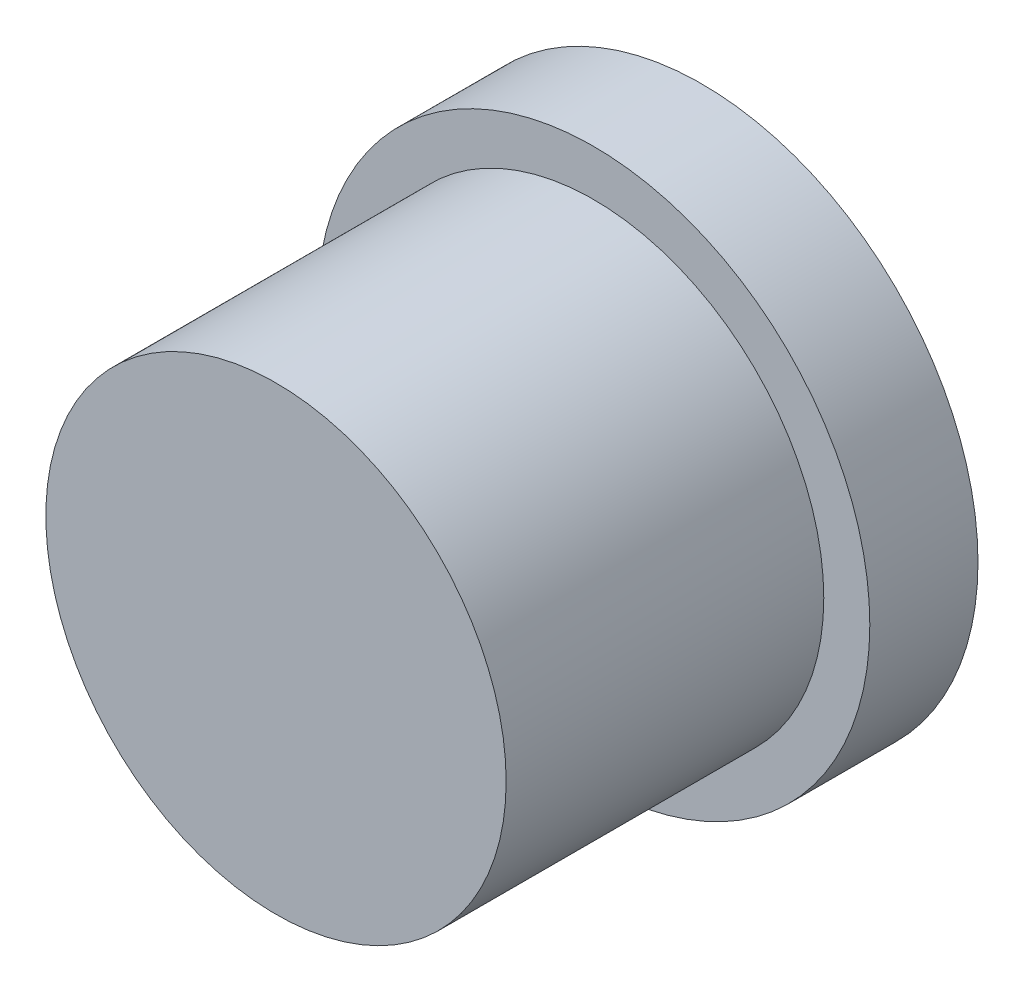
from build123d import *

# Parameters (mm, degrees)
SKETCH1_R           = 24
SKETCH1_R_2         = 1
BOSS_EXTRUDE1_DEPTH = 9.4
SKETCH1_4_R         = 20
BOSS_EXTRUDE2_DEPTH = 37
SKETCH1_5_R         = 17.5
SKETCH1_5_R_2       = 1
BOSS_EXTRUDE3_DEPTH = 4.5


with BuildPart() as part:
    # Sketch1 → Boss-Extrude1 (new body)
    with BuildSketch(Plane.XY):
        Circle(SKETCH1_R)
        with Locations((0, 12.5)):
            Circle(SKETCH1_R_2, mode=Mode.SUBTRACT)
        with Locations((0, -12.5)):
            Circle(SKETCH1_R_2, mode=Mode.SUBTRACT)
        with Locations((12.5, 0)):
            Circle(SKETCH1_R_2, mode=Mode.SUBTRACT)
        with Locations((-12.5, 0)):
            Circle(SKETCH1_R_2, mode=Mode.SUBTRACT)
    extrude(amount=BOSS_EXTRUDE1_DEPTH)

    # Sketch1<4> → Boss-Extrude2 (add)
    with BuildSketch(Plane.XY):
        Circle(SKETCH1_4_R)
    extrude(amount=BOSS_EXTRUDE2_DEPTH)

    # Sketch1<5> → Boss-Extrude3 (add)
    with BuildSketch(Plane.XY):
        Circle(SKETCH1_5_R)
        with Locations((0, -12.5)):
            Circle(SKETCH1_5_R_2, mode=Mode.SUBTRACT)
        with Locations((12.5, 0)):
            Circle(SKETCH1_5_R_2, mode=Mode.SUBTRACT)
        with Locations((-12.5, 0)):
            Circle(SKETCH1_5_R_2, mode=Mode.SUBTRACT)
        with Locations((0, 12.5)):
            Circle(SKETCH1_5_R_2, mode=Mode.SUBTRACT)
    extrude(amount=-BOSS_EXTRUDE3_DEPTH)


solid = part.part
